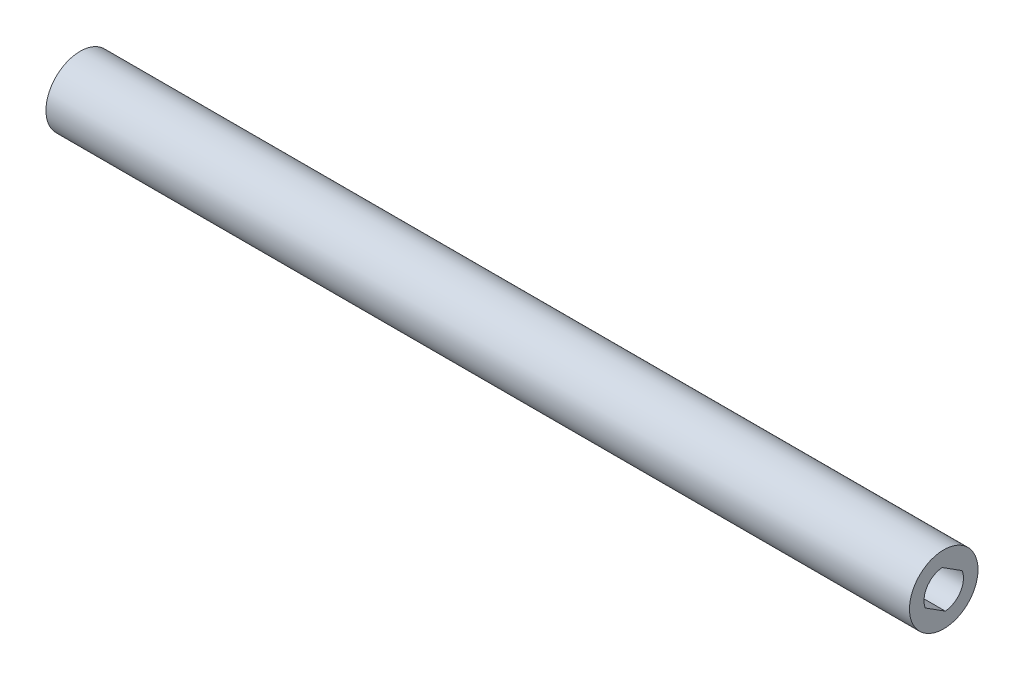
from build123d import *

# Parameters (mm, degrees)
SKETCH1_R           = 5
BOSS_EXTRUDE1_DEPTH = 126
CUT_EXTRUDE1_DEPTH  = 8
CUT_EXTRUDE2_START  = -8
CUT_EXTRUDE2_DEPTH  = 8


with BuildPart() as part:
    # Sketch1 → Boss-Extrude1 (new body)
    with BuildSketch(Plane(origin=(0, 0, 0), x_dir=(0, 0, -1), z_dir=(1, 0, 0))):
        Circle(SKETCH1_R)
    extrude(amount=BOSS_EXTRUDE1_DEPTH)

    # Sketch2 → Cut-Extrude1 (cut)
    with BuildSketch(Plane(origin=(126, 0, 0), x_dir=(0, 0, -1), z_dir=(1, 0, 0))):
        with BuildLine():
            Line((-2.688276978, -1.019211407), (0.225725397, -2.866125092))
            ThreePointArc((0.225725397, -2.866125092), (2.428335312, -1.539094738), (2.688276978, 1.019211407))
            Line((2.688276978, 1.019211407), (-0.225725397, 2.866125092))
            ThreePointArc((-0.225725397, 2.866125092), (-2.428335312, 1.539094738), (-2.688276978, -1.019211407))
        make_face()
    extrude(amount=-CUT_EXTRUDE1_DEPTH, mode=Mode.SUBTRACT)

    # Sketch3 → Cut-Extrude2 (cut)
    with BuildSketch(Plane.ZY.offset(CUT_EXTRUDE2_START)):
        with BuildLine():
            Line((0.225725397, 2.866125092), (-2.688276978, 1.019211407))
            ThreePointArc((-2.688276978, 1.019211407), (-2.428335312, -1.539094738), (-0.225725397, -2.866125092))
            Line((-0.225725397, -2.866125092), (2.688276978, -1.019211407))
            ThreePointArc((2.688276978, -1.019211407), (2.428335312, 1.539094738), (0.225725397, 2.866125092))
        make_face()
    extrude(amount=CUT_EXTRUDE2_DEPTH, mode=Mode.SUBTRACT)


solid = part.part
